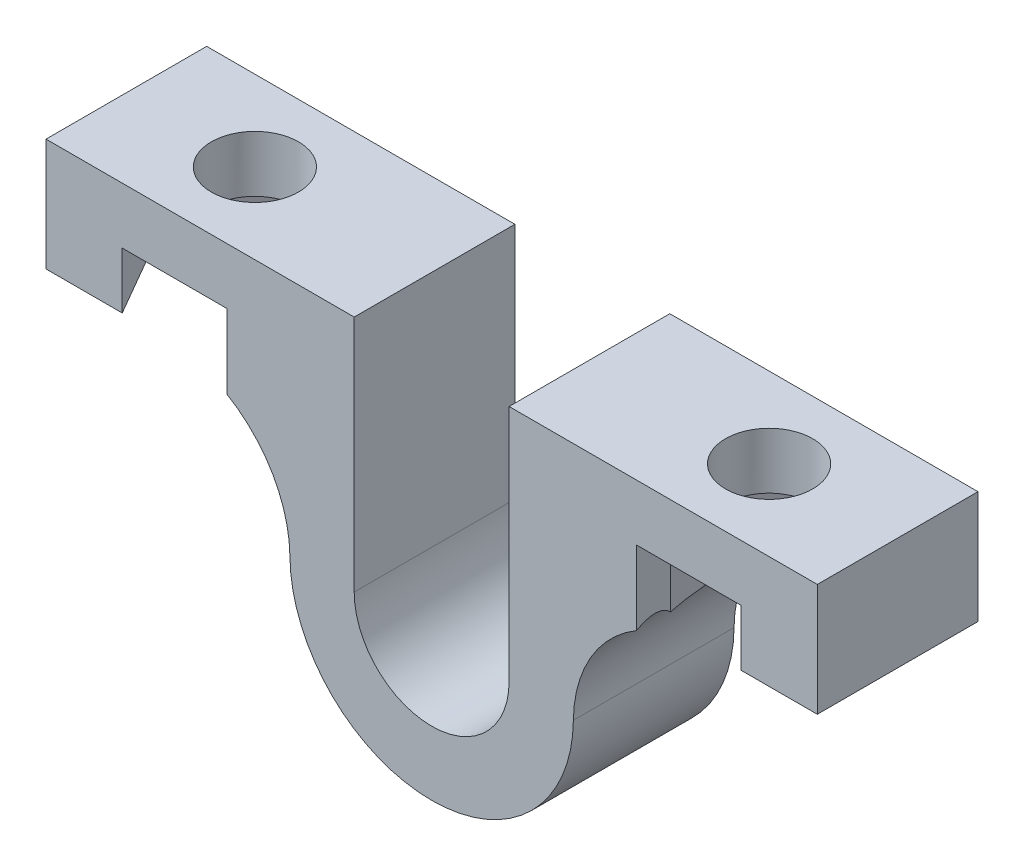
from build123d import *

# Parameters (mm, degrees)
BOSS_EXTRUDE1_DEPTH     = 7.9375
F_6_CLEARANCE_HOLE1_D   = 4.3053
CUT_EXTRUDE1_DEPTH      = 25.502197286
CUT_EXTRUDE1_DEPTH_BACK = 2.778125


with BuildPart() as part:
    # Sketch1 → Boss-Extrude1 (new body)
    with BuildSketch(Plane.XY):
        with BuildLine():
            Line((-19.05, 11.763375), (-19.05, 6.207125))
            Line((-19.05, 6.207125), (-13.350110486, 6.207125))
            ThreePointArc((-13.350110486, 6.207125), (-8.884072706, 4.37121478), (-7.000474108, -0.074920184))
            ThreePointArc((-7.000474108, -0.074920184), (-4.923806653, -4.976783982), (0, -7.000875))
            Line((0, -7.000875), (0, -3.825875))
            ThreePointArc((0, -3.825875), (-2.705302156, -2.705302156), (-3.825875, 0))
            Line((-3.825875, 0), (-3.825875, 11.763375))
            Line((-3.825875, 11.763375), (-19.05, 11.763375))
        make_face()
    extrude(amount=BOSS_EXTRUDE1_DEPTH)

    # #6 Clearance Hole1 (through all)
    with Locations(Plane(origin=(0, 11.763375, 0), x_dir=(1, 0, 0), z_dir=(0, 1, 0))):
        with Locations((-12.7, -3.96875)):
            Hole(F_6_CLEARANCE_HOLE1_D / 2)

    # Sketch4 → Cut-Extrude1 (cut, two sides: drawn at the far end of the back side and taken through both)
    with BuildSketch(Plane.XZ.offset(-6.207125).offset(-CUT_EXTRUDE1_DEPTH_BACK)):
        Polygon((-17.576011698, 3.96875), (-15.138005849, -0.254), (-10.261994151, -0.254), (-7.823988302, 3.96875), (-10.261994151, 8.1915), (-15.138005849, 8.1915), align=None)
    extrude(amount=CUT_EXTRUDE1_DEPTH + CUT_EXTRUDE1_DEPTH_BACK, mode=Mode.SUBTRACT)

    # Mirror1: part across plane


with BuildPart() as part_1:
    add(part.part)
    add(part.part.mirror(Plane(origin=(0, -3.825875, 7.9375), x_dir=(0, 0, 1), z_dir=(-1, 0, 0))))


solid = part_1.part
